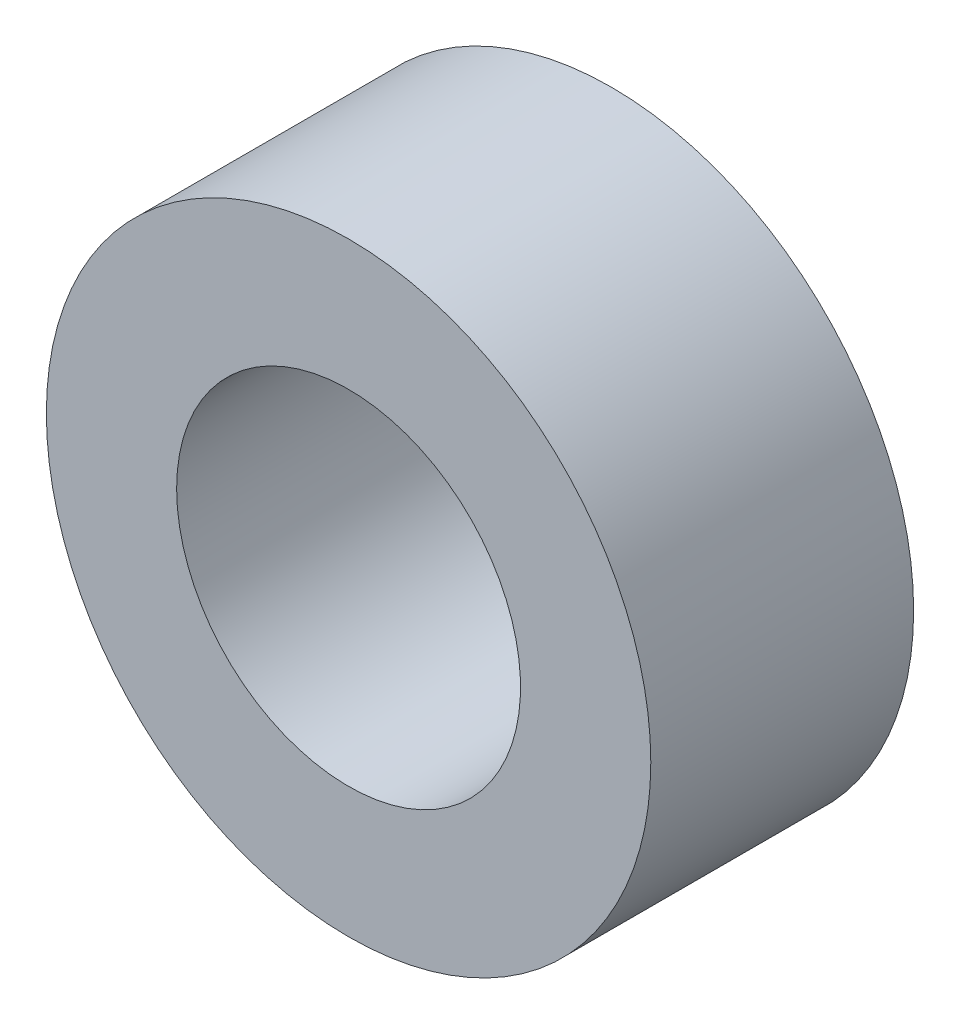
from build123d import *

# Parameters (mm, degrees)
SKETCH1_R           = 7.366
SKETCH1_R_2         = 4.191
BOSS_EXTRUDE1_DEPTH = 6.40625


with BuildPart() as part:
    # Sketch1 → Boss-Extrude1 (new body)
    with BuildSketch(Plane.XY):
        with Locations(Location((0, 0, 0), (0, 0, 180))):
            Circle(SKETCH1_R)
        with Locations(Location((0, 0, 0), (0, 0, 180))):
            Circle(SKETCH1_R_2, mode=Mode.SUBTRACT)
    extrude(amount=BOSS_EXTRUDE1_DEPTH)


solid = part.part
